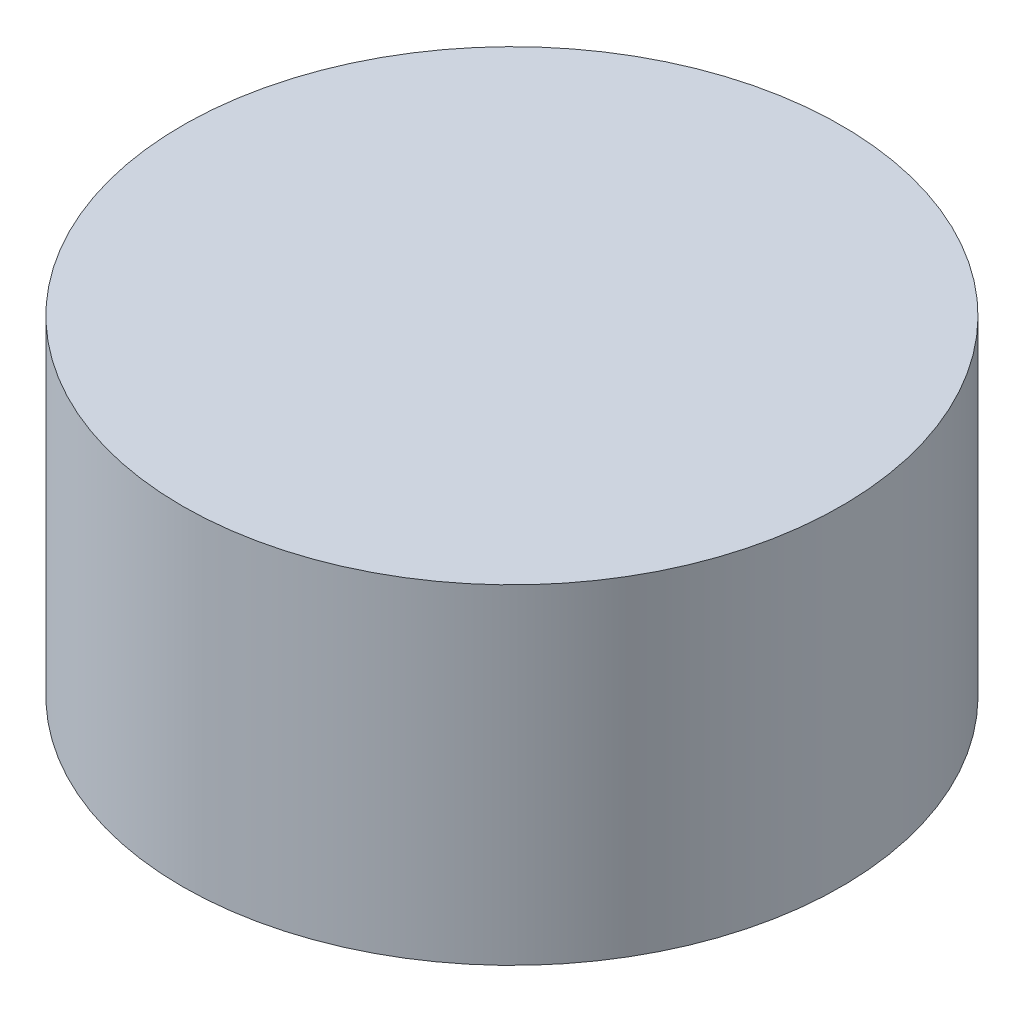
from build123d import *

# Parameters (mm, degrees)
SKETCH1_R  = 2
BASE_DEPTH = 2


with BuildPart() as part:
    # Sketch1 → Base (new body)
    with BuildSketch(Plane(origin=(0, 0, 0), x_dir=(1, 0, 0), z_dir=(0, 1, 0))):
        with Locations(Location((0, 0, 0), (0, 0, 270))):
            Circle(SKETCH1_R)
    extrude(amount=BASE_DEPTH)


solid = part.part
